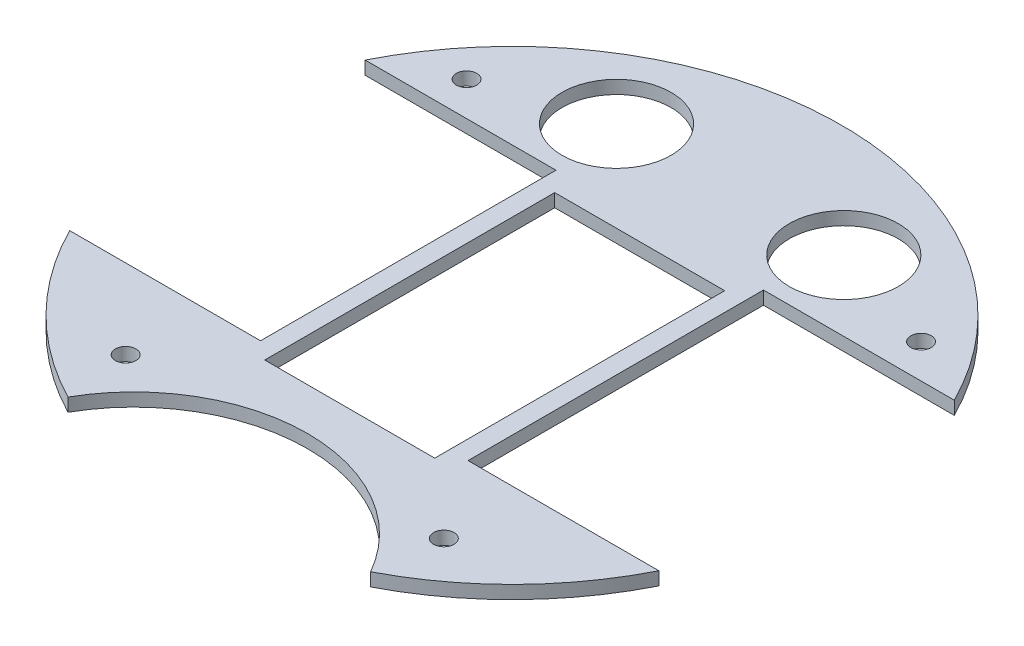
from build123d import *

# Parameters (mm, degrees)
BOSS_EXTRUDE1_DEPTH  = 2.9
SOLENOID_PLACEMENT_W = 37.4
SOLENOID_PLACEMENT_H = 63.8
CUT_EXTRUDE1_DEPTH   = 103.571487266
CUT_EXTRUDE2_DEPTH   = 103.571487266
SKETCH3_R            = 12
CUT_EXTRUDE3_DEPTH   = 98.286484159
SKETCH4_R            = 2.25
CUT_EXTRUDE4_DEPTH   = 98.416066437


with BuildPart() as part:
    # Sketch1 → Boss-Extrude1 (new body)
    with BuildSketch(Plane(origin=(0, 0, 0), x_dir=(1, 0, 0), z_dir=(0, 1, 0))):
        with BuildLine():
            ThreePointArc((33.29110537, -64.404598464), (0, 72.5), (-33.29110537, -64.404598464))
            ThreePointArc((-33.29110537, -64.404598464), (0, -44.989799638), (33.29110537, -64.404598464))
        make_face()
    extrude(amount=BOSS_EXTRUDE1_DEPTH)

    # solenoid placement → Cut-Extrude1 (cut, through all)
    with BuildSketch(Plane(origin=(0, 2.9, 0), x_dir=(1, 0, 0), z_dir=(0, 1, 0))):
        with Locations((0, -3.8)):
            Rectangle(SOLENOID_PLACEMENT_W, SOLENOID_PLACEMENT_H)
    extrude(amount=-CUT_EXTRUDE1_DEPTH, mode=Mode.SUBTRACT)

    # Sketch2 → Cut-Extrude2 (cut, through all)
    with BuildSketch(Plane(origin=(0, 2.9, 0), x_dir=(1, 0, 0), z_dir=(0, 1, 0))):
        with BuildLine():
            Line((-34.63, -32.5), (-22.83, -32.5))
            Line((-22.83, -32.5), (-22.83, 32.5))
            Line((-22.83, 32.5), (-64.807406984, 32.5))
            ThreePointArc((-64.807406984, 32.5), (-72.5, 0), (-64.807406984, -32.5))
            Line((-64.807406984, -32.5), (-34.63, -32.5))
        make_face()
        with BuildLine():
            Line((34.63, -32.5), (64.807406984, -32.5))
            ThreePointArc((64.807406984, -32.5), (72.5, 0), (64.807406984, 32.5))
            Line((64.807406984, 32.5), (22.83, 32.5))
            Line((22.83, 32.5), (22.83, -32.5))
            Line((22.83, -32.5), (34.63, -32.5))
        make_face()
    extrude(amount=-CUT_EXTRUDE2_DEPTH, mode=Mode.SUBTRACT)

    # Sketch3 → Cut-Extrude3 (cut, through all)
    with BuildSketch(Plane(origin=(0, 2.9, 0), x_dir=(1, 0, 0), z_dir=(0, 1, 0))):
        with Locations(Location((25, 48, 0), (0, 0, 270))):
            Circle(SKETCH3_R)
        with Locations(Location((-25, 48, 0), (0, 0, 270))):
            Circle(SKETCH3_R)
    extrude(amount=-CUT_EXTRUDE3_DEPTH, mode=Mode.SUBTRACT)

    # Sketch4 → Cut-Extrude4 (cut, through all)
    with BuildSketch(Plane(origin=(0, 5.8, 0), x_dir=(1, 0, 0), z_dir=(0, 1, 0))):
        with Locations(Location((35, -50, 0), (0, 0, 270))):
            Circle(SKETCH4_R)
        with Locations(Location((-35, -50, 0), (0, 0, 270))):
            Circle(SKETCH4_R)
        with Locations(Location((-50, 40, 0), (0, 0, 270))):
            Circle(SKETCH4_R)
        with Locations(Location((50, 40, 0), (0, 0, 270))):
            Circle(SKETCH4_R)
    extrude(amount=-CUT_EXTRUDE4_DEPTH, mode=Mode.SUBTRACT)


solid = part.part
